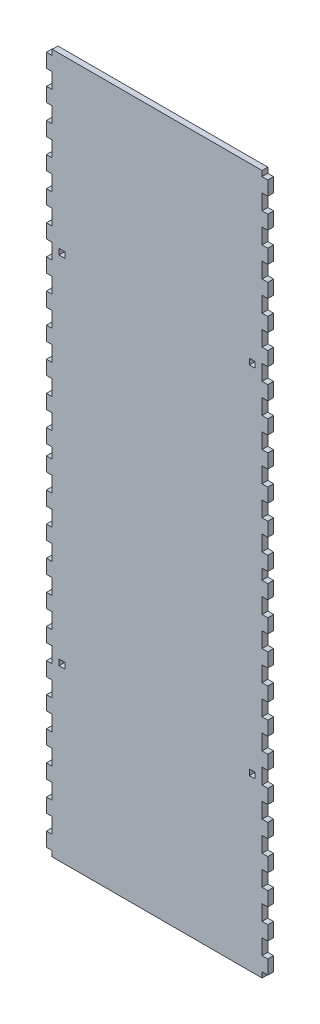
from build123d import *

# Parameters (mm, degrees)
CROQUIS1_W              = 3.3
CROQUIS1_H              = 3.3
SALIENTE_EXTRUIR1_DEPTH = 3.3


with BuildPart() as part:
    # Croquis1 → Saliente-Extruir1 (new body)
    with BuildSketch(Plane.XY):
        Polygon((63.3, 27.9389154), (60, 27.9389154), (60, 36.80802386), (63.3, 36.80802386), (63.3, 44.83802386), (60, 44.83802386), (60, 53.70713232), (63.3, 53.70713232), (63.3, 61.73713232), (60, 61.73713232), (60, 70.60624078), (63.3, 70.60624078), (63.3, 78.63624078), (60, 78.63624078), (60, 87.50534924), (63.3, 87.50534924), (63.3, 95.53534924), (60, 95.53534924), (60, 104.4044577), (63.3, 104.4044577), (63.3, 112.4344577), (60, 112.4344577), (60, 121.30356616), (63.3, 121.30356616), (63.3, 129.33356616), (60, 129.33356616), (60, 138.20267462), (63.3, 138.20267462), (63.3, 146.23267462), (60, 146.23267462), (60, 155.10178308), (63.3, 155.10178308), (63.3, 163.13178308), (60, 163.13178308), (60, 172.00089154), (63.3, 172.00089154), (63.3, 180.03089154), (60, 180.03089154), (60, 188.9), (63.3, 188.9), (63.3, 196.93), (60, 196.93), (60, 200), (-60, 200), (-60, 196.93), (-63.3, 196.93), (-63.3, 188.9), (-60, 188.9), (-60, 180.03089154), (-63.3, 180.03089154), (-63.3, 172.00089154), (-60, 172.00089154), (-60, 163.13178308), (-63.3, 163.13178308), (-63.3, 155.10178308), (-60, 155.10178308), (-60, 146.23267462), (-63.3, 146.23267462), (-63.3, 138.20267462), (-60, 138.20267462), (-60, 129.33356616), (-63.3, 129.33356616), (-63.3, 121.30356616), (-60, 121.30356616), (-60, 112.4344577), (-63.3, 112.4344577), (-63.3, 104.4044577), (-60, 104.4044577), (-60, 95.53534924), (-63.3, 95.53534924), (-63.3, 87.50534924), (-60, 87.50534924), (-60, 78.63624078), (-63.3, 78.63624078), (-63.3, 70.60624078), (-60, 70.60624078), (-60, 61.73713232), (-63.3, 61.73713232), (-63.3, 53.70713232), (-60, 53.70713232), (-60, 44.83802386), (-63.3, 44.83802386), (-63.3, 36.80802386), (-60, 36.80802386), (-60, 27.9389154), (-63.3, 27.9389154), (-63.3, 19.9089154), (-60, 19.9089154), (-60, 11.03980694), (-63.3, 11.03980694), (-63.3, 3.00980694), (-60, 3.00980694), (-60, -3.00980694), (-63.3, -3.00980694), (-63.3, -11.03980694), (-60, -11.03980694), (-60, -19.9089154), (-63.3, -19.9089154), (-63.3, -27.9389154), (-60, -27.9389154), (-60, -36.80802386), (-63.3, -36.80802386), (-63.3, -44.83802386), (-60, -44.83802386), (-60, -53.70713232), (-63.3, -53.70713232), (-63.3, -61.73713232), (-60, -61.73713232), (-60, -70.60624078), (-63.3, -70.60624078), (-63.3, -78.63624078), (-60, -78.63624078), (-60, -87.50534924), (-63.3, -87.50534924), (-63.3, -95.53534924), (-60, -95.53534924), (-60, -104.4044577), (-63.3, -104.4044577), (-63.3, -112.4344577), (-60, -112.4344577), (-60, -121.30356616), (-63.3, -121.30356616), (-63.3, -129.33356616), (-60, -129.33356616), (-60, -138.20267462), (-63.3, -138.20267462), (-63.3, -146.23267462), (-60, -146.23267462), (-60, -155.10178308), (-63.3, -155.10178308), (-63.3, -163.13178308), (-60, -163.13178308), (-60, -172.00089154), (-63.3, -172.00089154), (-63.3, -180.03089154), (-60, -180.03089154), (-60, -188.9), (-63.3, -188.9), (-63.3, -196.93), (-60, -196.93), (-60, -200), (60, -200), (60, -196.93), (63.3, -196.93), (63.3, -188.9), (60, -188.9), (60, -180.03089154), (63.3, -180.03089154), (63.3, -172.00089154), (60, -172.00089154), (60, -163.13178308), (63.3, -163.13178308), (63.3, -155.10178308), (60, -155.10178308), (60, -146.23267462), (63.3, -146.23267462), (63.3, -138.20267462), (60, -138.20267462), (60, -129.33356616), (63.3, -129.33356616), (63.3, -121.30356616), (60, -121.30356616), (60, -112.4344577), (63.3, -112.4344577), (63.3, -104.4044577), (60, -104.4044577), (60, -95.53534924), (63.3, -95.53534924), (63.3, -87.50534924), (60, -87.50534924), (60, -78.63624078), (63.3, -78.63624078), (63.3, -70.60624078), (60, -70.60624078), (60, -61.73713232), (63.3, -61.73713232), (63.3, -53.70713232), (60, -53.70713232), (60, -44.83802386), (63.3, -44.83802386), (63.3, -36.80802386), (60, -36.80802386), (60, -27.9389154), (63.3, -27.9389154), (63.3, -19.9089154), (60, -19.9089154), (60, -11.03980694), (63.3, -11.03980694), (63.3, -3.00980694), (60, -3.00980694), (60, 3.00980694), (63.3, 3.00980694), (63.3, 11.03980694), (60, 11.03980694), (60, 19.9089154), (63.3, 19.9089154), align=None)
        with Locations((-54.44567586, -101.72796576)):
            Rectangle(CROQUIS1_W, CROQUIS1_H, mode=Mode.SUBTRACT)
        with Locations((54.44567586, -101.72796576)):
            Rectangle(CROQUIS1_W, CROQUIS1_H, mode=Mode.SUBTRACT)
        with Locations((-54.44567586, 101.72796576)):
            Rectangle(CROQUIS1_W, CROQUIS1_H, mode=Mode.SUBTRACT)
        with Locations((54.44567586, 101.72796576)):
            Rectangle(CROQUIS1_W, CROQUIS1_H, mode=Mode.SUBTRACT)
    extrude(amount=SALIENTE_EXTRUIR1_DEPTH)


solid = part.part
